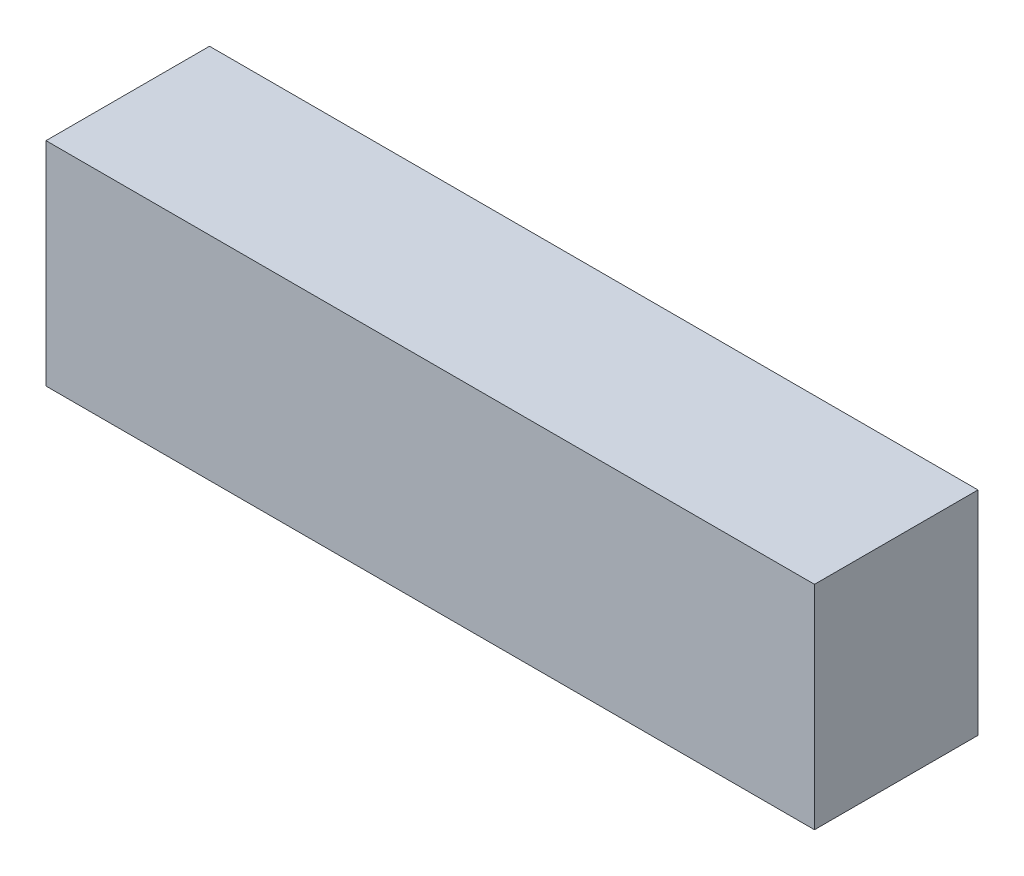
from build123d import *

# Parameters (mm, degrees)
SKETCH1_W           = 119.38
SKETCH1_H           = 25.4
BOSS_EXTRUDE1_DEPTH = 33.02


with BuildPart() as part:
    # Sketch1 → Boss-Extrude1 (new body)
    with BuildSketch(Plane(origin=(0, 0, 0), x_dir=(1, 0, 0), z_dir=(0, 1, 0))):
        Rectangle(SKETCH1_W, SKETCH1_H)
    extrude(amount=BOSS_EXTRUDE1_DEPTH)


solid = part.part
